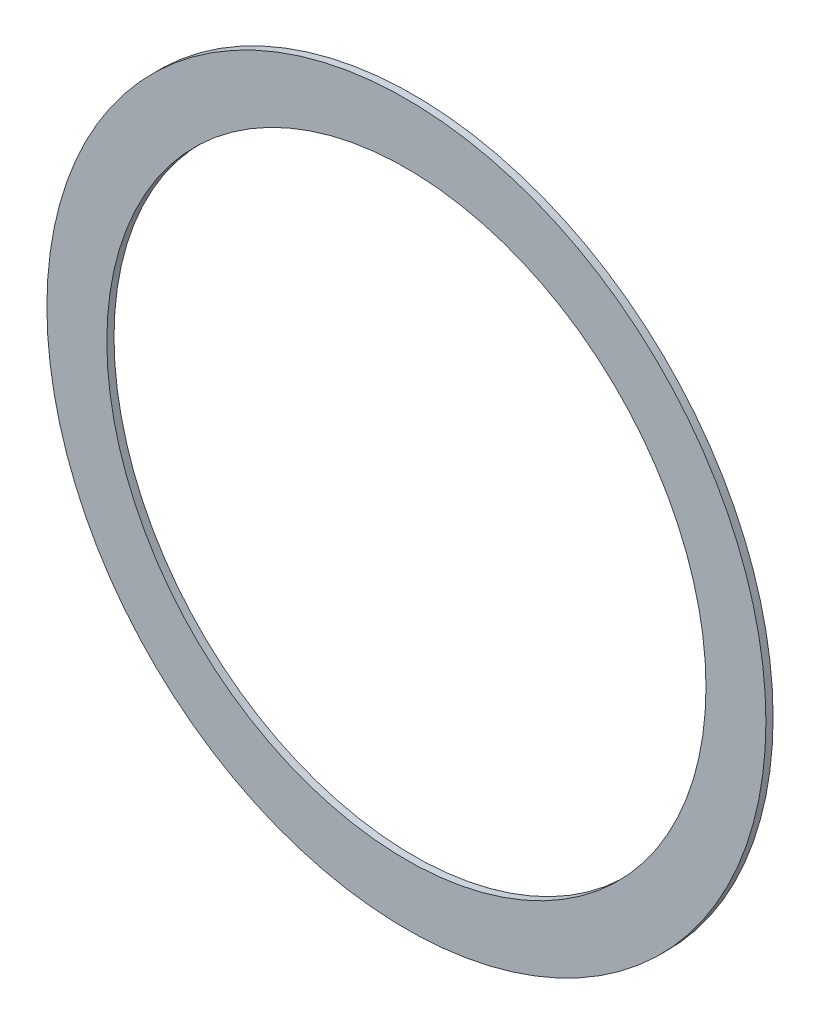
from build123d import *

# Parameters (mm, degrees)
SKETCH1_R           = 19.05
SKETCH1_R_2         = 15.875
BOSS_EXTRUDE1_DEPTH = 0.381


with BuildPart() as part:
    # Sketch1 → Boss-Extrude1 (new body)
    with BuildSketch(Plane.XY):
        with Locations(Location((0, 0, 0), (0, 0, 180))):
            Circle(SKETCH1_R)
        with Locations(Location((0, 0, 0), (0, 0, 180))):
            Circle(SKETCH1_R_2, mode=Mode.SUBTRACT)
    extrude(amount=BOSS_EXTRUDE1_DEPTH)


solid = part.part
